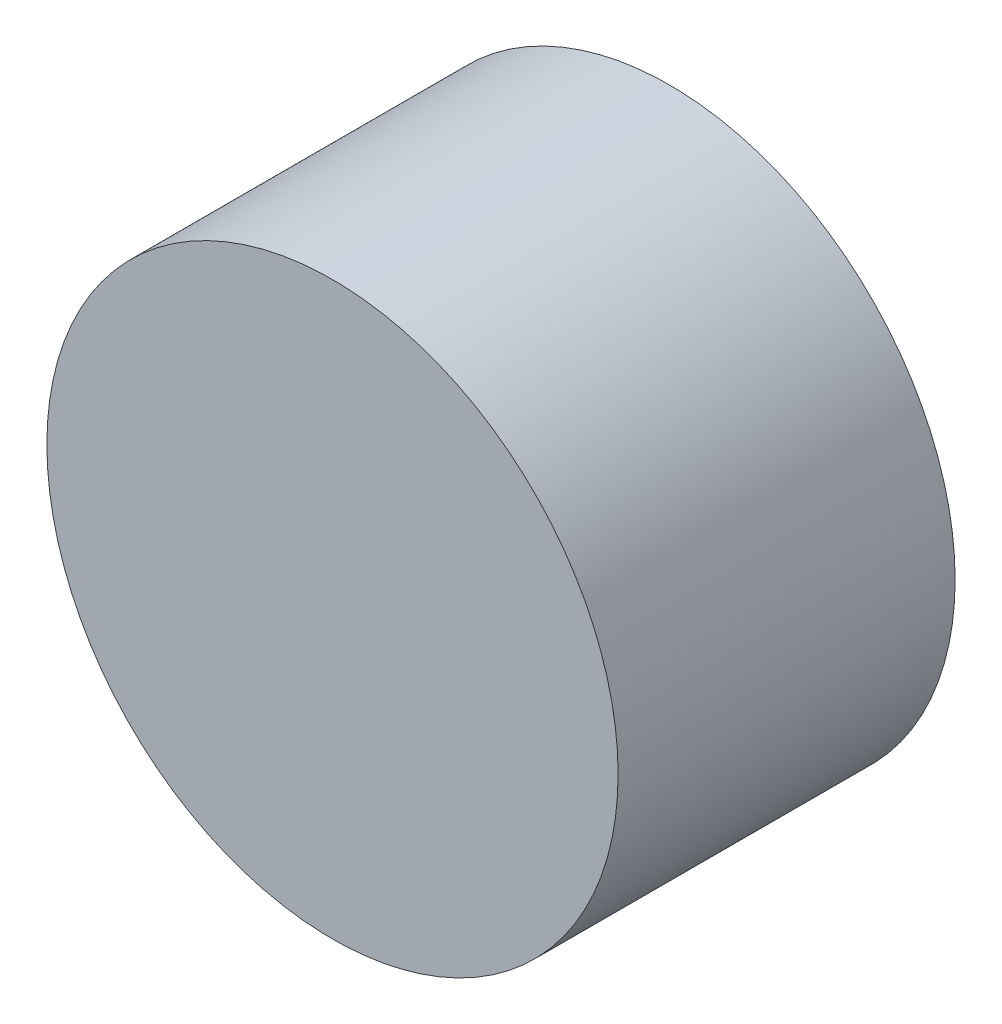
from build123d import *

# Parameters (mm, degrees)
SKETCH1_R           = 16.95
BOSS_EXTRUDE1_DEPTH = 20


with BuildPart() as part:
    # Sketch1 → Boss-Extrude1 (new body)
    with BuildSketch(Plane.XY):
        with Locations((0.100124668, 0.191175985)):
            Circle(SKETCH1_R)
    extrude(amount=BOSS_EXTRUDE1_DEPTH)


solid = part.part
